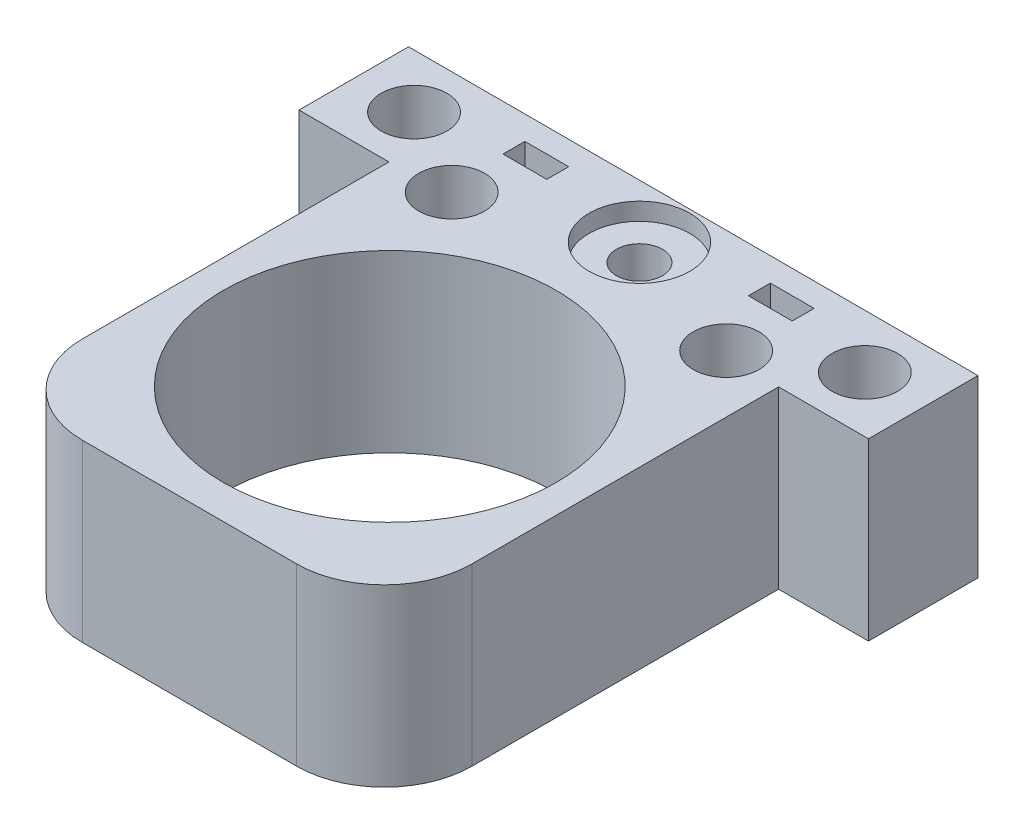
from build123d import *

# Parameters (mm, degrees)
BOSS_EXTRUDE1_DEPTH = 60
SKETCH2_R           = 7.5
CUT_EXTRUDE1_DEPTH  = 60
SKETCH3_R           = 5.25
CUT_EXTRUDE2_DEPTH  = 60
SKETCH4_R           = 11.5
CUT_EXTRUDE3_DEPTH  = 4
SKETCH5_W           = 10
SKETCH5_H           = 5
CUT_EXTRUDE4_DEPTH  = 60
SKETCH6_W           = 130
SKETCH6_H           = 90
BOSS_EXTRUDE2_DEPTH = 60
SKETCH7_R           = 38
CUT_EXTRUDE5_DEPTH  = 60
SKETCH8_W           = 130
SKETCH8_H           = 115
CUT_EXTRUDE6_DEPTH  = 20
SKETCH9_W           = 20.525641278
SKETCH9_H           = 90
CUT_EXTRUDE7_DEPTH  = 45
FILLET2_R           = 20
SKETCH10_R          = 7.5
CUT_EXTRUDE8_DEPTH  = 40


with BuildPart() as part:
    # Sketch1 → Boss-Extrude1 (new body)
    with BuildSketch(Plane(origin=(0, 0, 0), x_dir=(1, 0, 0), z_dir=(0, 1, 0))):
        with BuildLine():
            Line((-65, 25), (65, 25))
            Line((65, 25), (65, -25))
            Line((65, -25), (32.897568299, -25))
            ThreePointArc((32.897568299, -25), (0, -6.5), (-32.897568299, -25))
            Line((-32.897568299, -25), (-65, -25))
            Line((-65, -25), (-65, 25))
        make_face()
    extrude(amount=BOSS_EXTRUDE1_DEPTH)

    # Sketch2 → Cut-Extrude1 (cut)
    with BuildSketch(Plane(origin=(0, 60, 0), x_dir=(1, 0, 0), z_dir=(0, 1, 0))):
        with Locations(Location((-51.452605548, 12.714222387, 0), (0, 0, 270))):
            Circle(SKETCH2_R)
        with Locations(Location((51.452605548, 12.714222387, 0), (0, 0, 90))):
            Circle(SKETCH2_R)
    extrude(amount=-CUT_EXTRUDE1_DEPTH, mode=Mode.SUBTRACT)

    # Sketch3 → Cut-Extrude2 (cut)
    with BuildSketch(Plane(origin=(0, 60, 0), x_dir=(1, 0, 0), z_dir=(0, 1, 0))):
        with Locations(Location((0, 12.714222387, 0), (0, 0, 270))):
            Circle(SKETCH3_R)
    extrude(amount=-CUT_EXTRUDE2_DEPTH, mode=Mode.SUBTRACT)

    # Sketch4 → Cut-Extrude3 (cut)
    with BuildSketch(Plane(origin=(0, 60, 0), x_dir=(1, 0, 0), z_dir=(0, 1, 0))):
        with Locations(Location((0, 12.714222387, 0), (0, 0, 270))):
            Circle(SKETCH4_R)
    extrude(amount=-CUT_EXTRUDE3_DEPTH, mode=Mode.SUBTRACT)

    # Sketch5 → Cut-Extrude4 (cut)
    with BuildSketch(Plane(origin=(0, 60, 0), x_dir=(1, 0, 0), z_dir=(0, 1, 0))):
        with Locations((-52.884181241, -16.580341224)):
            Rectangle(SKETCH5_W, SKETCH5_H)
        with Locations((-28.013085243, 17.079406564)):
            Rectangle(SKETCH5_W, SKETCH5_H)
        with Locations((52.884181241, -16.580341224)):
            Rectangle(SKETCH5_W, SKETCH5_H)
        with Locations((28.013085243, 17.079406564)):
            Rectangle(SKETCH5_W, SKETCH5_H)
    extrude(amount=-CUT_EXTRUDE4_DEPTH, mode=Mode.SUBTRACT)

    # Sketch6 → Boss-Extrude2 (add)
    with BuildSketch(Plane(origin=(0, 60, 0), x_dir=(1, 0, 0), z_dir=(0, 1, 0))):
        with Locations((0, -45)):
            Rectangle(SKETCH6_W, SKETCH6_H)
    extrude(amount=-BOSS_EXTRUDE2_DEPTH)

    # Sketch7 → Cut-Extrude5 (cut)
    with BuildSketch(Plane(origin=(0, 60, 0), x_dir=(1, 0, 0), z_dir=(0, 1, 0))):
        with Locations(Location((0, -44.285777613, 0), (0, 0, 270))):
            Circle(SKETCH7_R)
    extrude(amount=-CUT_EXTRUDE5_DEPTH, mode=Mode.SUBTRACT)

    # Sketch8 → Cut-Extrude6 (cut)
    with BuildSketch(Plane.XZ):
        with Locations((0, 32.5)):
            Rectangle(SKETCH8_W, SKETCH8_H)
    extrude(amount=-CUT_EXTRUDE6_DEPTH, mode=Mode.SUBTRACT)

    # Sketch9 → Cut-Extrude7 (cut)
    with BuildSketch(Plane(origin=(0, 60, 0), x_dir=(1, 0, 0), z_dir=(0, 1, 0))):
        with Locations((-54.737179361, -45)):
            Rectangle(SKETCH9_W, SKETCH9_H)
        with Locations((54.737179361, -45)):
            Rectangle(SKETCH9_W, SKETCH9_H)
    extrude(amount=-CUT_EXTRUDE7_DEPTH, mode=Mode.SUBTRACT)

    # Fillet2
    fillet2_edges = [part.edges().sort_by_distance(p)[0] for p in [
        (-44.474358722, 40, 90),
        (44.474358722, 40, 90),
    ]]
    fillet(fillet2_edges, radius=FILLET2_R)

    # Sketch10 → Cut-Extrude8 (cut)
    with BuildSketch(Plane(origin=(0, 60, 0), x_dir=(1, 0, 0), z_dir=(0, 1, 0))):
        with Locations(Location((-51.452605548, 12.714222387, 0), (0, 0, 270))):
            Circle(SKETCH10_R)
        with Locations(Location((-31.326829319, 1.180399397, 0), (0, 0, 270))):
            Circle(SKETCH10_R)
        with Locations(Location((31.326829319, 1.180399397, 0), (0, 0, 90))):
            Circle(SKETCH10_R)
    extrude(amount=-CUT_EXTRUDE8_DEPTH, mode=Mode.SUBTRACT)


solid = part.part
